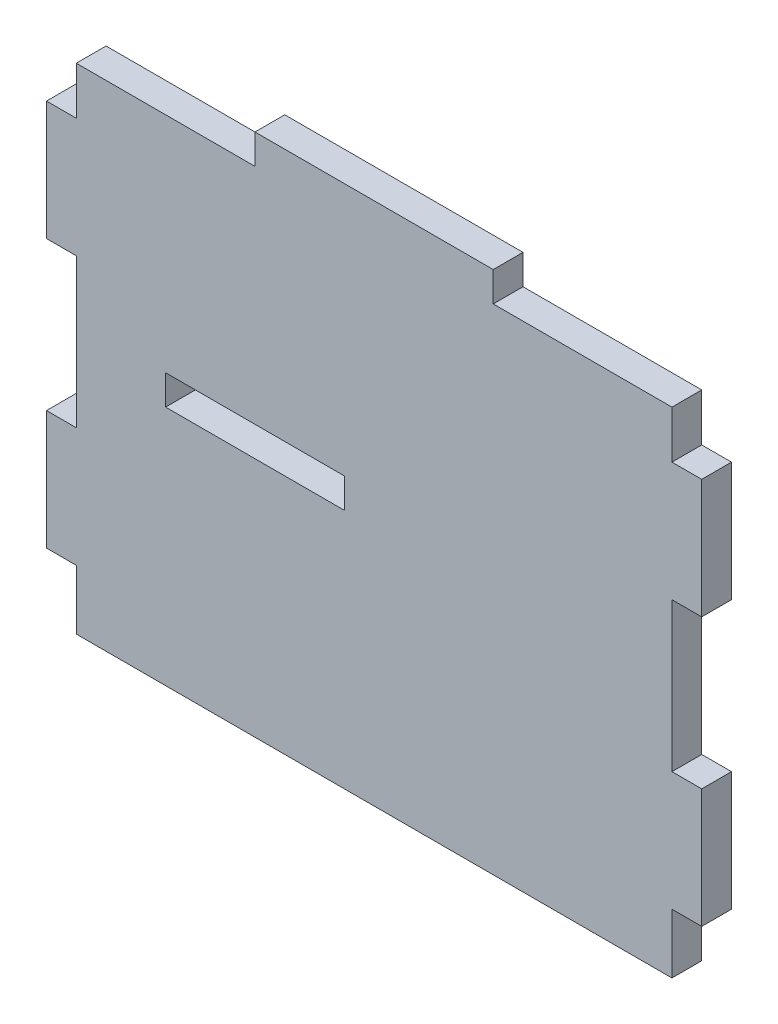
from build123d import *

# Parameters (mm, degrees)
SKETCH_1_W      = 30
SKETCH_1_H      = 5
EXTRUDE_1_DEPTH = 5


with BuildPart() as part:
    # 草图1 → 凸台-拉伸1 (new body)
    with BuildSketch(Plane.XY):
        Polygon((0, 75), (0, 83), (30, 83), (30, 88), (70, 88), (70, 83), (100, 83), (100, 75), (105, 75), (105, 55), (100, 55), (100, 30), (105, 30), (105, 10), (100, 10), (100, 0), (0, 0), (0, 10), (-5, 10), (-5, 30), (0, 30), (0, 55), (-5, 55), (-5, 75), align=None)
        with Locations((30, 43)):
            Rectangle(SKETCH_1_W, SKETCH_1_H, mode=Mode.SUBTRACT)
    extrude(amount=EXTRUDE_1_DEPTH)


solid = part.part
